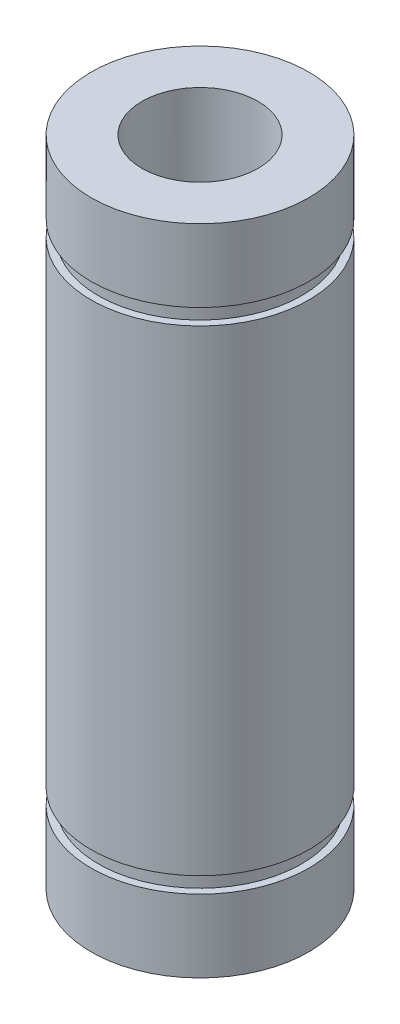
from build123d import *
from build123d.topology import SkipClean

# Parameters (mm, degrees)
SKETCH1_R           = 7.5
SKETCH1_R_2         = 4
BOSS_EXTRUDE1_DEPTH = 5
BOSS_EXTRUDE2_START = 1.1
SKETCH2_R           = 7
SKETCH2_R_2         = 4
BOSS_EXTRUDE2_DEPTH = 1.1
BOSS_EXTRUDE3_START = 32.8
SKETCH3_R           = 7.5
SKETCH3_R_2         = 4
BOSS_EXTRUDE3_DEPTH = 32.8
BOSS_EXTRUDE5_START = 1.1
SKETCH5_R           = 7
SKETCH5_R_2         = 4
BOSS_EXTRUDE5_DEPTH = 1.1
BOSS_EXTRUDE6_START = 5
SKETCH6_R           = 7.5
SKETCH6_R_2         = 4
BOSS_EXTRUDE6_DEPTH = 5


with BuildPart() as part:
    # Sketch1 → Boss-Extrude1 (new body)
    with BuildSketch(Plane(origin=(0, 0, 0), x_dir=(1, 0, 0), z_dir=(0, 1, 0))):
        with Locations(Location((0, 0, 0), (0, 0, 270))):
            Circle(SKETCH1_R)
        with Locations(Location((0, 0, 0), (0, 0, 270))):
            Circle(SKETCH1_R_2, mode=Mode.SUBTRACT)
    extrude(amount=BOSS_EXTRUDE1_DEPTH)

    # Sketch2 → Boss-Extrude2 (add)
    with SkipClean():  # the faces are left unmerged after this step: merging them gives an invalid solid
        with BuildSketch(Plane.XZ.offset(BOSS_EXTRUDE2_START)):
            with Locations(Location((0, 0, 0), (0, 0, 90))):
                Circle(SKETCH2_R)
            with Locations(Location((0, 0, 0), (0, 0, 270))):
                Circle(SKETCH2_R_2, mode=Mode.SUBTRACT)
        extrude(amount=-BOSS_EXTRUDE2_DEPTH)

    # Sketch3 → Boss-Extrude3 (add)
    with SkipClean():  # the faces are left unmerged after this step: merging them gives an invalid solid
        with BuildSketch(Plane.XZ.offset(1.1).offset(BOSS_EXTRUDE3_START)):
            with Locations(Location((0, 0, 0), (0, 0, 90))):
                Circle(SKETCH3_R)
            with Locations(Location((0, 0, 0), (0, 0, 270))):
                Circle(SKETCH3_R_2, mode=Mode.SUBTRACT)
        extrude(amount=-BOSS_EXTRUDE3_DEPTH)

    # Sketch5 → Boss-Extrude5 (add)
    with SkipClean():  # the faces are left unmerged after this step: merging them gives an invalid solid
        with BuildSketch(Plane.XZ.offset(33.9).offset(BOSS_EXTRUDE5_START)):
            with Locations(Location((0, 0, 0), (0, 0, 90))):
                Circle(SKETCH5_R)
            with Locations(Location((0, 0, 0), (0, 0, 270))):
                Circle(SKETCH5_R_2, mode=Mode.SUBTRACT)
        extrude(amount=-BOSS_EXTRUDE5_DEPTH)

    # Sketch6 → Boss-Extrude6 (add)
    with SkipClean():  # the faces are left unmerged after this step: merging them gives an invalid solid
        with BuildSketch(Plane.XZ.offset(35).offset(BOSS_EXTRUDE6_START)):
            with Locations(Location((0, 0, 0), (0, 0, 90))):
                Circle(SKETCH6_R)
            with Locations(Location((0, 0, 0), (0, 0, 270))):
                Circle(SKETCH6_R_2, mode=Mode.SUBTRACT)
        extrude(amount=-BOSS_EXTRUDE6_DEPTH)


solid = part.part
